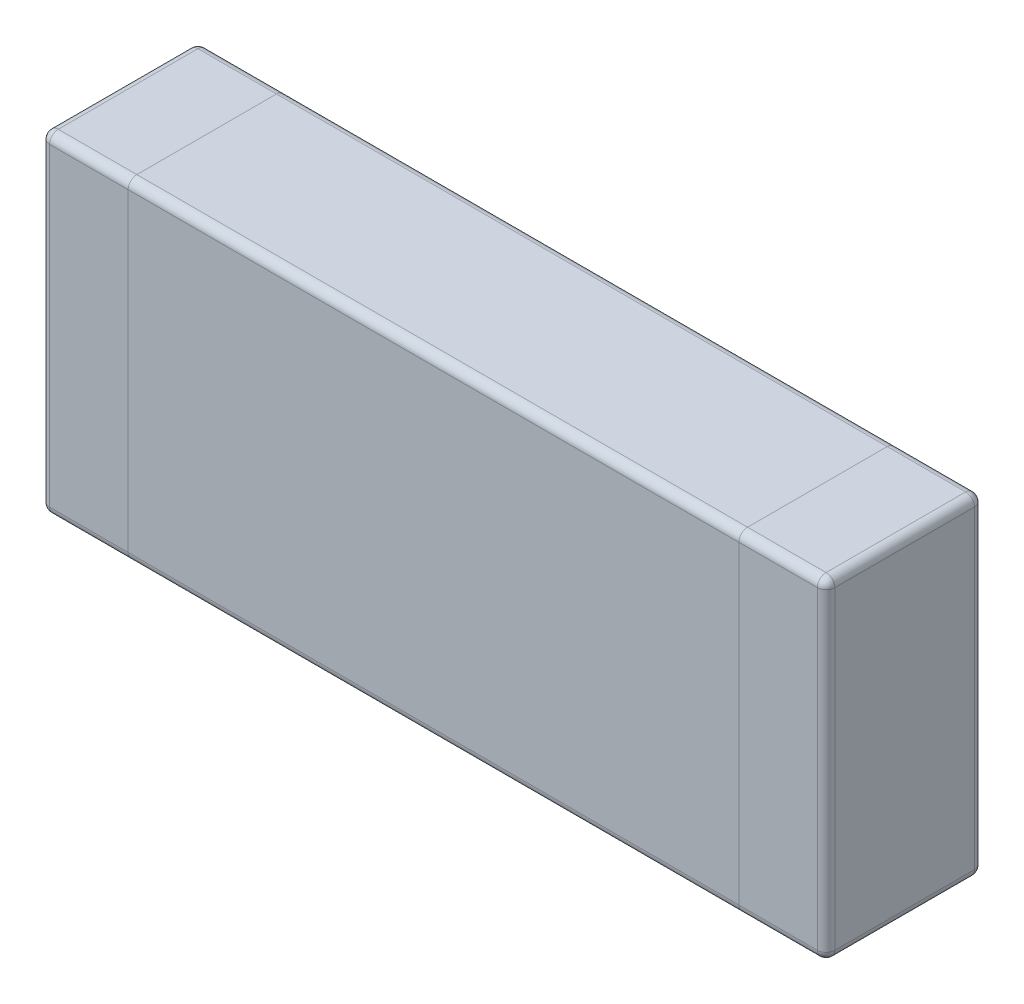
from build123d import *

# Parameters (mm, degrees)
SKETCH1_W      = 4.5
SKETCH1_H      = 0.9
EXTRUDE1_DEPTH = 1.9
FILLET1_R      = 0.05


with BuildPart() as part:
    # Sketch1 → Extrude1 (new body)
    with BuildSketch(Plane(origin=(0, 0, 0), x_dir=(1, 0, 0), z_dir=(0, 1, 0))):
        Rectangle(SKETCH1_W, SKETCH1_H)
    extrude(amount=EXTRUDE1_DEPTH)

    # Fillet1
    fillet1_edges = [part.edges().sort_by_distance(p)[0] for p in [
        (-2.25, 1.9, 0),
        (0, 1.9, 0.45),
        (2.25, 1.9, 0),
        (0, 0, 0.45),
        (-2.25, 0, 0),
        (0, 0, -0.45),
        (2.25, 0, 0),
        (0, 1.9, -0.45),
        (2.25, 0.95, 0.45),
        (-2.25, 0.95, 0.45),
        (-2.25, 0.95, -0.45),
        (2.25, 0.95, -0.45),
    ]]
    fillet(fillet1_edges, radius=FILLET1_R)


solid = part.part
